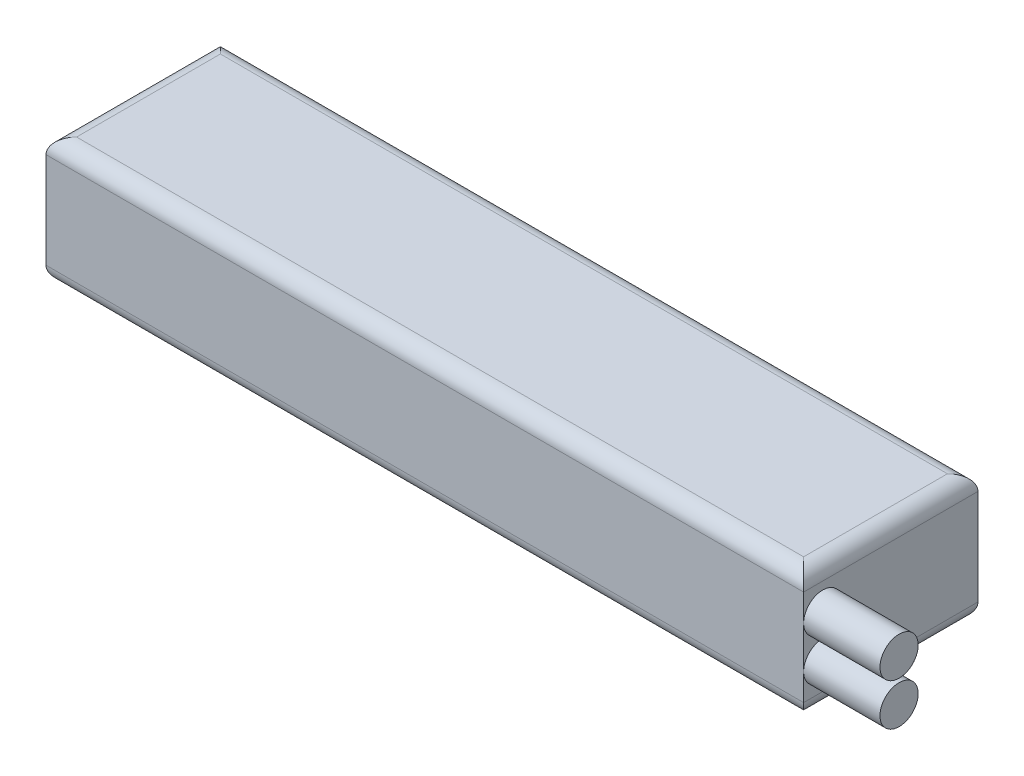
from build123d import *

# Parameters (mm, degrees)
SKETCH1_W           = 126
SKETCH1_H           = 29
BOSS_EXTRUDE1_DEPTH = 21
SKETCH2_R           = 3.175
BOSS_EXTRUDE2_DEPTH = 12.7
FILLET1_R           = 2.54


with BuildPart() as part:
    # Sketch1 → Boss-Extrude1 (new body)
    with BuildSketch(Plane(origin=(0, 0, 0), x_dir=(1, 0, 0), z_dir=(0, 1, 0))):
        with Locations((60.293650794, -13.726190476)):
            Rectangle(SKETCH1_W, SKETCH1_H)
    extrude(amount=BOSS_EXTRUDE1_DEPTH)

    # Sketch2 → Boss-Extrude2 (add)
    with BuildSketch(Plane(origin=(123.293650794, 0, 0), x_dir=(0, 0, -1), z_dir=(1, 0, 0))):
        with Locations(Location((-25.051190476, 13.9925, 0), (0, 0, 180))):
            Circle(SKETCH2_R)
        with Locations(Location((-25.051190476, 7.0075, 0), (0, 0, 180))):
            Circle(SKETCH2_R)
    extrude(amount=BOSS_EXTRUDE2_DEPTH)

    # Fillet1
    fillet1_edges = [part.edges().sort_by_distance(p)[0] for p in [
        (123.293650794, 21, 13.726190476),
        (60.293650794, 21, -0.773809524),
        (-2.706349206, 21, 13.726190476),
        (60.293650794, 0, -0.773809524),
        (123.293650794, 0, 13.726190476),
        (60.293650794, 0, 28.226190476),
        (-2.706349206, 0, 13.726190476),
        (60.293650794, 21, 28.226190476),
    ]]
    fillet(fillet1_edges, radius=FILLET1_R)


solid = part.part
